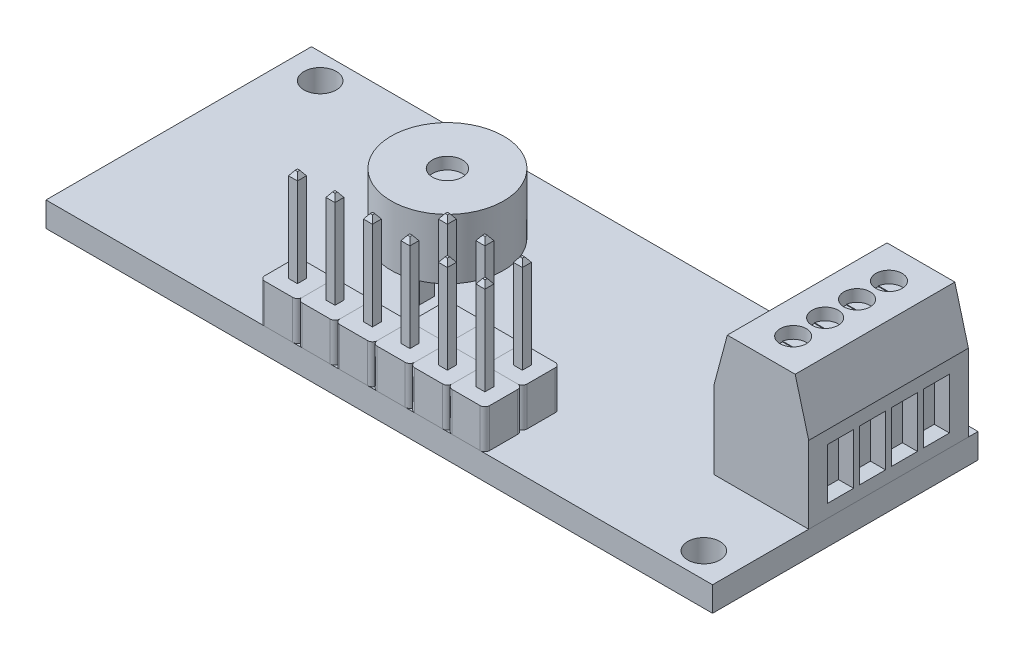
from build123d import *
from OCP.BRepFilletAPI import BRepFilletAPI_MakeChamfer

# Parameters (mm, degrees)
SKETCH1_W                 = 44.45
SKETCH1_H                 = 17.7038
BOSS_EXTRUDE1_DEPTH       = 0.8255
CUT_EXTRUDE1_DEPTH        = 24.979836522
CUT_EXTRUDE1_DEPTH_BACK   = 24.979836522
SKETCH2_R                 = 1.075
BOSS_EXTRUDE2_DEPTH       = 10.65
SKETCH4_W                 = 2.5
SKETCH4_H                 = 2.499995
BOSS_EXTRUDE3_DEPTH       = 2.599
SKETCH5_W                 = 0.6
SKETCH5_H                 = 0.6
BOSS_EXTRUDE4_DEPTH       = 6.25
CHAMFER1_SIZE             = 0.3175
CHAMFER1_SIZE2            = 0.222315893
FILLET1_R                 = 0.3175
LPATTERN2_COUNT           = 6
LPATTERN2_PITCH           = 2.5
LPATTERN3_COUNT           = 2
LPATTERN3_PITCH           = 2.5
SKETCH7_R                 = 3.75
BOSS_EXTRUDE5_DEPTH       = 6.45
SKETCH8_R                 = 3.75
SKETCH8_W                 = 1
SKETCH8_H                 = 1
CUT_EXTRUDE2_DEPTH        = 2.44
SKETCH9_R                 = 1
CUT_EXTRUDE3_DEPTH        = 0.79375
SKETCH10_R                = 0.875
CUT_EXTRUDE4_DEPTH        = 0.79375
SKETCH11_W                = 1.73
SKETCH11_H                = 3.4
CUT_EXTRUDE5_DEPTH        = 0.79375
CUT_EXTRUDE5_DRAFT        = -15
LPATTERN4_COPY_1_SKETCH_W = 1.73
LPATTERN4_COPY_1_SKETCH_H = 3.4
LPATTERN4_COPY_1_DEPTH    = 0.79375
LPATTERN4_COPY_1_DRAFT    = -15
LPATTERN4_COPY_2_SKETCH_W = 1.73
LPATTERN4_COPY_2_SKETCH_H = 3.4
LPATTERN4_COPY_2_DEPTH    = 0.79375
LPATTERN4_COPY_2_DRAFT    = -15
LPATTERN4_COPY_3_SKETCH_W = 1.73
LPATTERN4_COPY_3_SKETCH_H = 3.4
LPATTERN4_COPY_3_DEPTH    = 0.79375
LPATTERN4_COPY_3_DRAFT    = -15
CUT_EXTRUDE6_DEPTH        = 0.049609375
LPATTERN5_COUNT           = 4
LPATTERN5_PITCH           = 2.13


with BuildPart() as part:
    # Sketch1 → Boss-Extrude1 (new, symmetric)
    with BuildSketch(Plane(origin=(0, 0, 0), x_dir=(1, 0, 0), z_dir=(0, 1, 0))):
        Rectangle(SKETCH1_W, SKETCH1_H)
    extrude(amount=BOSS_EXTRUDE1_DEPTH, both=True)

    # Sketch2 → Cut-Extrude1 (cut, two sides: drawn at the far end of the back side and taken through both)
    with BuildSketch(Plane(origin=(0, 0.8255, 0), x_dir=(1, 0, 0), z_dir=(0, 1, 0)).offset(-CUT_EXTRUDE1_DEPTH_BACK)):
        with Locations(Location((-19.97, 7.1769, 0), (0, 0, 270))):
            Circle(SKETCH2_R)
        with Locations(Location((19.97, -7.1769, 0), (0, 0, 270))):
            Circle(SKETCH2_R)
    extrude(amount=CUT_EXTRUDE1_DEPTH + CUT_EXTRUDE1_DEPTH_BACK, mode=Mode.SUBTRACT)


with BuildPart() as body_2:
    # Sketch3 → Boss-Extrude2 (new body)
    with BuildSketch(Plane(origin=(0, 0, -8.21190001), x_dir=(-1, 0, 0), z_dir=(0, 0, -1))):
        Polygon((-22.225, 0.8255), (-22.225, 5.9555), (-21.322011222, 9.3255), (-16.797988778, 9.3255), (-15.895, 5.9555), (-15.895, 0.8255), align=None)
    extrude(amount=-BOSS_EXTRUDE2_DEPTH)

    # Sketch10 → Cut-Extrude4 (cut)
    with BuildSketch(Plane(origin=(0, 9.3255, 0), x_dir=(1, 0, 0), z_dir=(0, 1, 0))):
        with Locations(Location((19.06, 6.08190001, 0), (0, 0, 270))):
            Circle(SKETCH10_R)
        with Locations(Location((19.06, 3.95190001, 0), (0, 0, 270))):
            Circle(SKETCH10_R)
        with Locations(Location((19.06, 1.82190001, 0), (0, 0, 270))):
            Circle(SKETCH10_R)
        with Locations(Location((19.06, -0.30809999, 0), (0, 0, 270))):
            Circle(SKETCH10_R)
    extrude(amount=-CUT_EXTRUDE4_DEPTH, mode=Mode.SUBTRACT)


with BuildPart() as body_3:
    # Sketch4 → Boss-Extrude3 (new body)
    with BuildSketch(Plane(origin=(0, 0.8255, 0), x_dir=(1, 0, 0), z_dir=(0, 1, 0))):
        with Locations((5.795, -7.6019025)):
            Rectangle(SKETCH4_W, SKETCH4_H)
    extrude(amount=BOSS_EXTRUDE3_DEPTH)

    # Fillet1
    fillet1_edges = [body_3.edges().sort_by_distance(p)[0] for p in [
        (4.545, 2.125, 8.8519),
        (4.545, 2.125, 6.351905),
        (7.045, 2.125, 6.351905),
        (7.045, 2.125, 8.8519),
    ]]
    fillet(fillet1_edges, radius=FILLET1_R)


with BuildPart() as body_4:
    # Sketch5 → Boss-Extrude4 (new body)
    with BuildSketch(Plane(origin=(0, 3.4245, 0), x_dir=(1, 0, 0), z_dir=(0, 1, 0))):
        with Locations((5.795, -7.6019025)):
            Rectangle(SKETCH5_W, SKETCH5_H)
    extrude(amount=BOSS_EXTRUDE4_DEPTH)

    # Chamfer1: one chamfer whose edges measure the first distance from different faces: ONE call of the kernel's chamfer builder (chamfer() names one face for all edges)
    chamfer1_edges_1 = [body_4.edges().sort_by_distance(p)[0] for p in [
        (5.495, 9.6745, 7.6019025),
    ]]
    chamfer1_side_1 = [body_4.faces().sort_by_distance(p)[0] for p in [
        (5.495, 6.5495, 7.6019025),
    ]]
    chamfer1_edges_2 = [body_4.edges().sort_by_distance(p)[0] for p in [
        (5.795, 9.6745, 7.9019025),
    ]]
    chamfer1_side_2 = [body_4.faces().sort_by_distance(p)[0] for p in [
        (5.795, 6.5495, 7.9019025),
    ]]
    chamfer1_edges_3 = [body_4.edges().sort_by_distance(p)[0] for p in [
        (6.095, 9.6745, 7.6019025),
    ]]
    chamfer1_side_3 = [body_4.faces().sort_by_distance(p)[0] for p in [
        (6.095, 6.5495, 7.6019025),
    ]]
    chamfer1_edges_4 = [body_4.edges().sort_by_distance(p)[0] for p in [
        (5.795, 9.6745, 7.3019025),
    ]]
    chamfer1_side_4 = [body_4.faces().sort_by_distance(p)[0] for p in [
        (5.795, 6.5495, 7.3019025),
    ]]
    chamfer1 = BRepFilletAPI_MakeChamfer(body_4.part.solid().wrapped)
    for e in chamfer1_edges_1:
        chamfer1.Add(CHAMFER1_SIZE, CHAMFER1_SIZE2, e.wrapped, chamfer1_side_1[0].wrapped)  # the first distance lies on this face
    for e in chamfer1_edges_2:
        chamfer1.Add(CHAMFER1_SIZE, CHAMFER1_SIZE2, e.wrapped, chamfer1_side_2[0].wrapped)  # the first distance lies on this face
    for e in chamfer1_edges_3:
        chamfer1.Add(CHAMFER1_SIZE, CHAMFER1_SIZE2, e.wrapped, chamfer1_side_3[0].wrapped)  # the first distance lies on this face
    for e in chamfer1_edges_4:
        chamfer1.Add(CHAMFER1_SIZE, CHAMFER1_SIZE2, e.wrapped, chamfer1_side_4[0].wrapped)  # the first distance lies on this face
    add(Compound.cast(chamfer1.Shape()), mode=Mode.REPLACE)


with BuildPart() as lpattern2_1:
    # LPattern2: pattern copy
    add(body_4.part.moved(Location(Vector(-1, 0, 0) * (1 * LPATTERN2_PITCH))))


with BuildPart() as lpattern2_2:
    # LPattern2: pattern copy
    add(body_4.part.moved(Location(Vector(-1, 0, 0) * (2 * LPATTERN2_PITCH))))


with BuildPart() as lpattern2_3:
    # LPattern2: pattern copy
    add(body_4.part.moved(Location(Vector(-1, 0, 0) * (3 * LPATTERN2_PITCH))))


with BuildPart() as lpattern2_4:
    # LPattern2: pattern copy
    add(body_4.part.moved(Location(Vector(-1, 0, 0) * (4 * LPATTERN2_PITCH))))


with BuildPart() as lpattern2_5:
    # LPattern2: pattern copy
    add(body_4.part.moved(Location(Vector(-1, 0, 0) * (5 * LPATTERN2_PITCH))))


with BuildPart() as lpattern2_6:
    # LPattern2: pattern copy
    add(body_3.part.moved(Location(Vector(-1, 0, 0) * (1 * LPATTERN2_PITCH))))


with BuildPart() as lpattern2_7:
    # LPattern2: pattern copy
    add(body_3.part.moved(Location(Vector(-1, 0, 0) * (2 * LPATTERN2_PITCH))))


with BuildPart() as lpattern2_8:
    # LPattern2: pattern copy
    add(body_3.part.moved(Location(Vector(-1, 0, 0) * (3 * LPATTERN2_PITCH))))


with BuildPart() as lpattern2_9:
    # LPattern2: pattern copy
    add(body_3.part.moved(Location(Vector(-1, 0, 0) * (4 * LPATTERN2_PITCH))))


with BuildPart() as lpattern2_10:
    # LPattern2: pattern copy
    add(body_3.part.moved(Location(Vector(-1, 0, 0) * (5 * LPATTERN2_PITCH))))


with BuildPart() as lpattern3_1:
    # LPattern3: pattern copy
    add(body_4.part.moved(Location(Vector(0, 0, -1) * (1 * LPATTERN3_PITCH))))


with BuildPart() as lpattern3_2:
    # LPattern3: pattern copy
    add(lpattern2_1.part.moved(Location(Vector(0, 0, -1) * (1 * LPATTERN3_PITCH))))


with BuildPart() as lpattern3_3:
    # LPattern3: pattern copy
    add(lpattern2_2.part.moved(Location(Vector(0, 0, -1) * (1 * LPATTERN3_PITCH))))


with BuildPart() as lpattern3_4:
    # LPattern3: pattern copy
    add(lpattern2_7.part.moved(Location(Vector(0, 0, -1) * (1 * LPATTERN3_PITCH))))


with BuildPart() as lpattern3_5:
    # LPattern3: pattern copy
    add(lpattern2_6.part.moved(Location(Vector(0, 0, -1) * (1 * LPATTERN3_PITCH))))


with BuildPart() as lpattern3_6:
    # LPattern3: pattern copy
    add(body_3.part.moved(Location(Vector(0, 0, -1) * (1 * LPATTERN3_PITCH))))


with BuildPart() as body_21:
    # Sketch7 → Boss-Extrude5 (new body)
    with BuildSketch(Plane(origin=(0, 0.8255, 0), x_dir=(1, 0, 0), z_dir=(0, 1, 0))):
        with Locations(Location((-4.205, -0.101905, 0), (0, 0, 90))):
            Circle(SKETCH7_R)
    extrude(amount=BOSS_EXTRUDE5_DEPTH)

    # Sketch8 → Cut-Extrude2 (cut)
    with BuildSketch(Plane(origin=(0, 0.8255, 0), x_dir=(1, 0, 0), z_dir=(0, 1, 0))):
        with Locations(Location((-4.205, -0.101905, 0), (0, 0, 90))):
            Circle(SKETCH8_R)
        with Locations((-4.205, 1.773095)):
            Rectangle(SKETCH8_W, SKETCH8_H, mode=Mode.SUBTRACT)
        with Locations((-4.205, -1.976905)):
            Rectangle(SKETCH8_W, SKETCH8_H, mode=Mode.SUBTRACT)
    extrude(amount=CUT_EXTRUDE2_DEPTH, mode=Mode.SUBTRACT)

    # Sketch9 → Cut-Extrude3 (cut)
    with BuildSketch(Plane(origin=(0, 7.2755, 0), x_dir=(1, 0, 0), z_dir=(0, 1, 0))):
        with Locations(Location((-4.205, -0.101905, 0), (0, 0, 270))):
            Circle(SKETCH9_R)
    extrude(amount=-CUT_EXTRUDE3_DEPTH, mode=Mode.SUBTRACT)


with BuildPart() as cut_extrude5_tool:
    # Sketch11 → Cut-Extrude5 (with draft: the straight prism first)
    with BuildSketch(Plane(origin=(22.225, 0, 0), x_dir=(0, 0, -1), z_dir=(1, 0, 0))):
        with Locations((-0.30809999, 3.3905)):
            Rectangle(SKETCH11_W, SKETCH11_H)
    extrude(amount=-CUT_EXTRUDE5_DEPTH)
    # Cut-Extrude5: the draft: its side faces are tilted about the plane it starts from
    cut_extrude5_sides = [cut_extrude5_tool.faces().sort_by_distance(p)[0] for p in [
        (21.828125, 5.0905, 0.30809999),
        (21.828125, 3.3905, 1.17309999),
        (21.828125, 1.6905, 0.30809999),
        (21.828125, 3.3905, -0.55690001),
    ]]
    draft(cut_extrude5_sides, Plane(origin=(22.225, 0, 0), x_dir=(0, 0, -1), z_dir=(1, 0, 0)), CUT_EXTRUDE5_DRAFT)


with BuildPart() as body_2_1:
    add(body_2.part)

    # Cut-Extrude5: cut by cut_extrude5_tool
    add(cut_extrude5_tool.part, mode=Mode.SUBTRACT)


with BuildPart() as lpattern4_copy_1_tool:
    # LPattern4 copy 1 sketch → LPattern4 copy 1 (with draft: the straight prism first)
    with BuildSketch(Plane(origin=(22.225, 0, -2.13), x_dir=(0, 0, -1), z_dir=(1, 0, 0))):
        with Locations((-0.30809999, 3.3905)):
            Rectangle(LPATTERN4_COPY_1_SKETCH_W, LPATTERN4_COPY_1_SKETCH_H)
    extrude(amount=-LPATTERN4_COPY_1_DEPTH)
    # LPattern4 copy 1: the draft: its side faces are tilted about the plane it starts from
    lpattern4_copy_1_sides = [lpattern4_copy_1_tool.faces().sort_by_distance(p)[0] for p in [
        (21.828125, 5.0905, -1.82190001),
        (21.828125, 3.3905, -0.95690001),
        (21.828125, 1.6905, -1.82190001),
        (21.828125, 3.3905, -2.68690001),
    ]]
    draft(lpattern4_copy_1_sides, Plane(origin=(22.225, 0, -2.13), x_dir=(0, 0, -1), z_dir=(1, 0, 0)), LPATTERN4_COPY_1_DRAFT)


with BuildPart() as body_2_2:
    add(body_2_1.part)

    # LPattern4 copy 1: cut by lpattern4_copy_1_tool
    add(lpattern4_copy_1_tool.part, mode=Mode.SUBTRACT)


with BuildPart() as lpattern4_copy_2_tool:
    # LPattern4 copy 2 sketch → LPattern4 copy 2 (with draft: the straight prism first)
    with BuildSketch(Plane(origin=(22.225, 0, -4.26), x_dir=(0, 0, -1), z_dir=(1, 0, 0))):
        with Locations((-0.30809999, 3.3905)):
            Rectangle(LPATTERN4_COPY_2_SKETCH_W, LPATTERN4_COPY_2_SKETCH_H)
    extrude(amount=-LPATTERN4_COPY_2_DEPTH)
    # LPattern4 copy 2: the draft: its side faces are tilted about the plane it starts from
    lpattern4_copy_2_sides = [lpattern4_copy_2_tool.faces().sort_by_distance(p)[0] for p in [
        (21.828125, 5.0905, -3.95190001),
        (21.828125, 3.3905, -3.08690001),
        (21.828125, 1.6905, -3.95190001),
        (21.828125, 3.3905, -4.81690001),
    ]]
    draft(lpattern4_copy_2_sides, Plane(origin=(22.225, 0, -4.26), x_dir=(0, 0, -1), z_dir=(1, 0, 0)), LPATTERN4_COPY_2_DRAFT)


with BuildPart() as body_2_3:
    add(body_2_2.part)

    # LPattern4 copy 2: cut by lpattern4_copy_2_tool
    add(lpattern4_copy_2_tool.part, mode=Mode.SUBTRACT)


with BuildPart() as lpattern4_copy_3_tool:
    # LPattern4 copy 3 sketch → LPattern4 copy 3 (with draft: the straight prism first)
    with BuildSketch(Plane(origin=(22.225, 0, -6.39), x_dir=(0, 0, -1), z_dir=(1, 0, 0))):
        with Locations((-0.30809999, 3.3905)):
            Rectangle(LPATTERN4_COPY_3_SKETCH_W, LPATTERN4_COPY_3_SKETCH_H)
    extrude(amount=-LPATTERN4_COPY_3_DEPTH)
    # LPattern4 copy 3: the draft: its side faces are tilted about the plane it starts from
    lpattern4_copy_3_sides = [lpattern4_copy_3_tool.faces().sort_by_distance(p)[0] for p in [
        (21.828125, 5.0905, -6.08190001),
        (21.828125, 3.3905, -5.21690001),
        (21.828125, 1.6905, -6.08190001),
        (21.828125, 3.3905, -6.94690001),
    ]]
    draft(lpattern4_copy_3_sides, Plane(origin=(22.225, 0, -6.39), x_dir=(0, 0, -1), z_dir=(1, 0, 0)), LPATTERN4_COPY_3_DRAFT)


with BuildPart() as body_2_4:
    add(body_2_3.part)

    # LPattern4 copy 3: cut by lpattern4_copy_3_tool
    add(lpattern4_copy_3_tool.part, mode=Mode.SUBTRACT)

    # Sketch12 → Cut-Extrude6 (cut)
    with BuildSketch(Plane(origin=(0, 8.53175, 0), x_dir=(1, 0, 0), z_dir=(0, 1, 0))):
        with BuildLine():
            Line((18.19952139, -0.46684999), (19.92047861, -0.46684999))
            ThreePointArc((19.92047861, -0.46684999), (19.935, -0.30809999), (19.92047861, -0.14934999))
            Line((19.92047861, -0.14934999), (18.19952139, -0.14934999))
            ThreePointArc((18.19952139, -0.14934999), (18.185, -0.30809999), (18.19952139, -0.46684999))
        make_face()
    cut_extrude6 = extrude(amount=-CUT_EXTRUDE6_DEPTH, mode=Mode.SUBTRACT)

    # LPattern5: Cut-Extrude6 ×4
    with Locations(*[(0, 0, -i * LPATTERN5_PITCH) for i in range(1, LPATTERN5_COUNT)]):
        add(cut_extrude6, mode=Mode.SUBTRACT)


solid = Compound([part.part, body_3.part, body_4.part, lpattern2_1.part, lpattern2_2.part, lpattern2_3.part, lpattern2_4.part, lpattern2_5.part, lpattern2_6.part, lpattern2_7.part, lpattern2_8.part, lpattern2_9.part, lpattern2_10.part, lpattern3_1.part, lpattern3_2.part, lpattern3_3.part, lpattern3_4.part, lpattern3_5.part, lpattern3_6.part, body_21.part, body_2_4.part])
